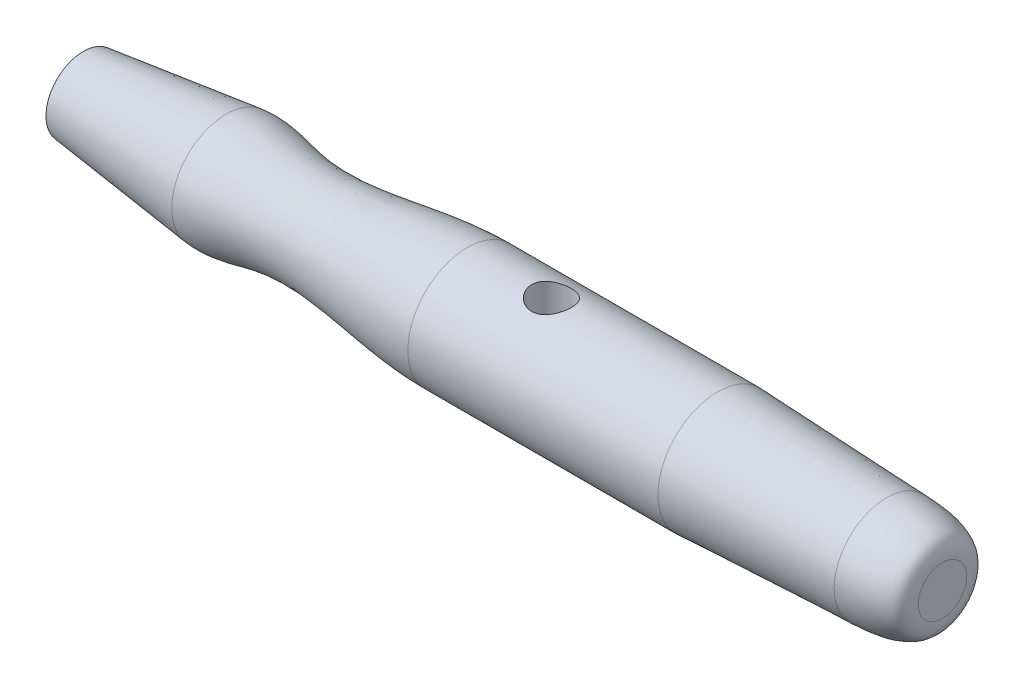
from build123d import *

# Parameters (mm, degrees)
CUT_EXTRUDE1_REACH      = 142.114
CUT_EXTRUDE1_END_RADIUS = 19.05
SKETCH3_R               = 6.35


with BuildPart() as part:
    # Sketch1 → Revolve1 (revolve)
    with BuildSketch(Plane.XY, mode=Mode.PRIVATE) as revolve1_sk:
        with BuildLine():
            Line((-137.5, 0), (137.5, 0))
            Line((137.5, 0), (137.5, 7.747))
            add(Edge.make_bspline(
                [(119.602, 16.764), (126.446685513, 16.474787936), (132.251729161, 15.730759902), (137.5, 12.322795174), (137.5, 7.747)],
                knots=[0, 0, 0, 0, 0.656247862, 1, 1, 1, 1], degree=3))
            Line((119.602, 16.764), (65.5, 19.05))
            Line((65.5, 19.05), (-14.564, 19.05))
            add(Edge.make_bspline(
                [(-91.78, 17.399), (-84.901336541, 18.220618135), (-60.549292723, 10.012805319), (-35.82944709, 19.05), (-14.564, 19.05)],
                knots=[0, 0, 0, 0, 0.244238151, 1, 1, 1, 1], degree=3))
            Line((-91.78, 17.399), (-137.5, 11.938))
            Line((-137.5, 11.938), (-137.5, 0))
        make_face()
    revolve(revolve1_sk.sketch.rotate(Axis((-137.5, 0, 0), (1, 0, 0)), 180), axis=Axis((-137.5, 0, 0), (1, 0, 0)))

    # Cut-Extrude1: up to this cylinder (the profile starts inside it)
    cut_extrude1_end = Plane(origin=(12.36, 0, 0), z_dir=(-1, 0, 0)) * Cylinder(CUT_EXTRUDE1_END_RADIUS, 323.328, mode=Mode.PRIVATE)
    # Sketch3 → Cut-Extrude1 (cut, up to the surface)
    with BuildSketch(Plane(origin=(0, 0, 0), x_dir=(1, 0, 0), z_dir=(0, 1, 0)), mode=Mode.PRIVATE) as cut_extrude1_sk1:
        with Locations(Location((12.36, 0, 0), (0, 0, 90))):
            Circle(SKETCH3_R)
    cut_extrude1_tool1 = extrude(cut_extrude1_sk1.sketch, amount=CUT_EXTRUDE1_REACH, mode=Mode.PRIVATE) & cut_extrude1_end
    add(cut_extrude1_tool1.solids().sort_by_distance((12.36, 0, 0))[0], mode=Mode.SUBTRACT)


solid = part.part
